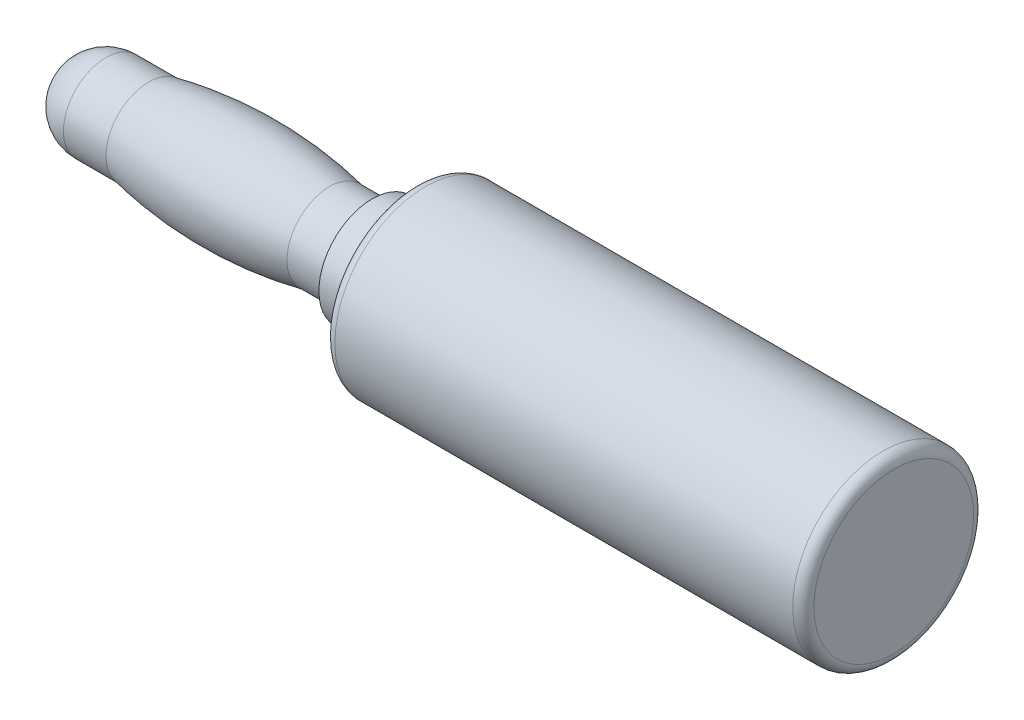
from build123d import *

# Parameters (mm, degrees)
CHAMFER1_SIZE      = 0.5
FILLET1_R          = 0.5
SKETCH3_R          = 2
CUT_EXTRUDE1_DEPTH = 25.4


with BuildPart() as part:
    # Sketch1 → Revolve1 (revolve)
    with BuildSketch(Plane.XY):
        with BuildLine():
            Line((0, 0), (-39, 0))
            ThreePointArc((-39, 0), (-38.414213562, 1.414213562), (-37, 2))
            Line((-37, 2), (-35, 2))
            ThreePointArc((-35, 2), (-30.75, 2.432654399), (-26.5, 2))
            Line((-26.5, 2), (-24.5, 2))
            Line((-24.5, 2), (-24.5, 2.5))
            Line((-24.5, 2.5), (-22.5, 2.5))
            Line((-22.5, 2.5), (-22.5, 4.25))
            Line((-22.5, 4.25), (0, 4.25))
            Line((0, 4.25), (0, 0))
        make_face()
    revolve(axis=Axis((-39, 0, 0), (-1, 0, 0)))

    # Chamfer1
    chamfer1_edges = [part.edges().sort_by_distance(p)[0] for p in [
        (-22.5, -2.5, 0),
    ]]
    chamfer(chamfer1_edges, length=CHAMFER1_SIZE)

    # Fillet1
    fillet1_edges = [part.edges().sort_by_distance(p)[0] for p in [
        (0, -4.25, 0),
        (-22.5, -4.25, 0),
    ]]
    fillet(fillet1_edges, radius=FILLET1_R)

    # Sketch3 → Cut-Extrude1 (cut)
    with BuildSketch(Plane(origin=(0, 0, 0), x_dir=(1, 0, 0), z_dir=(0, 1, 0))):
        with Locations(Location((-19.05, 0, 0), (0, 0, 270))):
            Circle(SKETCH3_R)
        with Locations(Location((-12.7, 0, 0), (0, 0, 270))):
            Circle(SKETCH3_R)
    extrude(amount=-CUT_EXTRUDE1_DEPTH, mode=Mode.SUBTRACT)


solid = part.part
